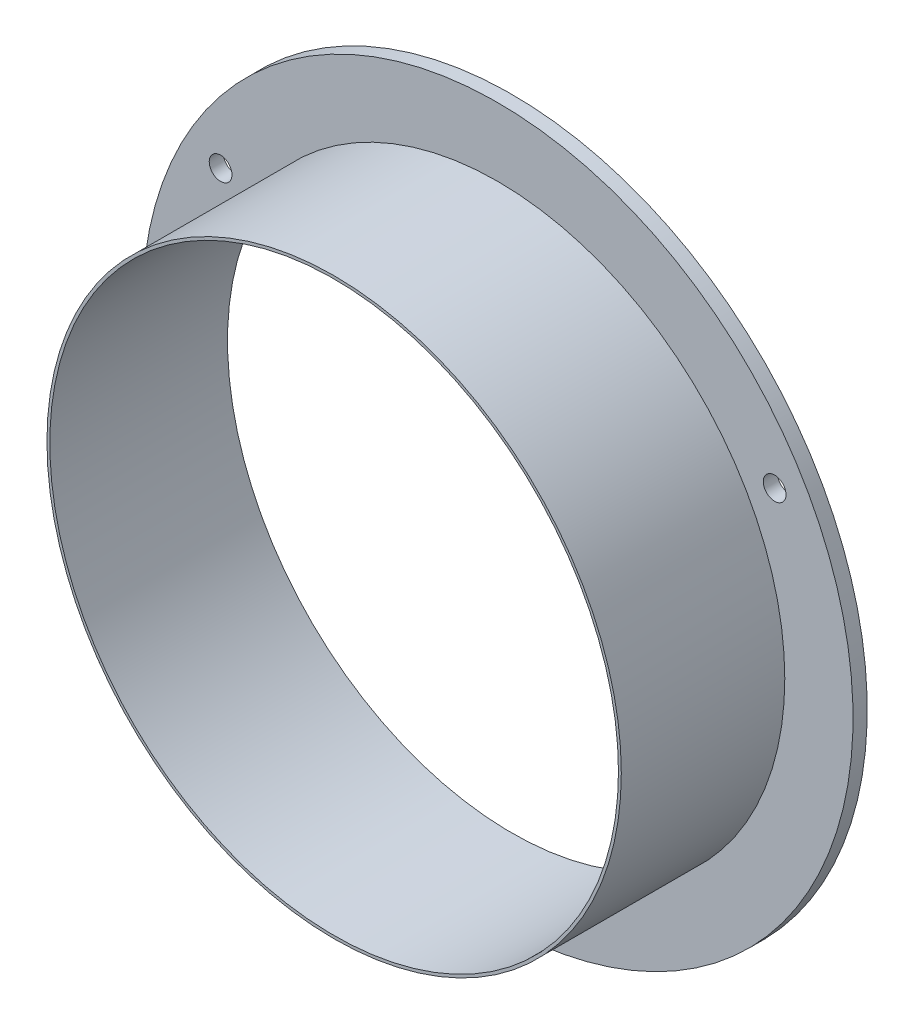
from build123d import *

# Parameters (mm, degrees)
ESQUISSE1_R        = 40.4
ESQUISSE1_R_2      = 40
BOSS_EXTRU_1_DEPTH = 25
BOSS_EXTRU_2_START = -2
ESQUISSE2_R        = 50
ESQUISSE2_R_2      = 1.6
ESQUISSE2_R_3      = 40
BOSS_EXTRU_2_DEPTH = 2


with BuildPart() as part:
    # Esquisse1 → Boss.-Extru.1 (new body)
    with BuildSketch(Plane.XY):
        Circle(ESQUISSE1_R)
        Circle(ESQUISSE1_R_2, mode=Mode.SUBTRACT)
    extrude(amount=-BOSS_EXTRU_1_DEPTH)

    # Esquisse2 → Boss.-Extru.2 (add)
    with BuildSketch(Plane(origin=(0, 0, -25), x_dir=(-1, 0, 0), z_dir=(0, 0, -1)).offset(BOSS_EXTRU_2_START)):
        Circle(ESQUISSE2_R)
        with Locations((-38.97114317, 22.5)):
            Circle(ESQUISSE2_R_2, mode=Mode.SUBTRACT)
        with Locations((38.97114317, 22.5)):
            Circle(ESQUISSE2_R_2, mode=Mode.SUBTRACT)
        with Locations((0, -45)):
            Circle(ESQUISSE2_R_2, mode=Mode.SUBTRACT)
        with Locations(Location((0, 0, 0), (0, 0, 180))):
            Circle(ESQUISSE2_R_3, mode=Mode.SUBTRACT)
    extrude(amount=BOSS_EXTRU_2_DEPTH)


solid = part.part
